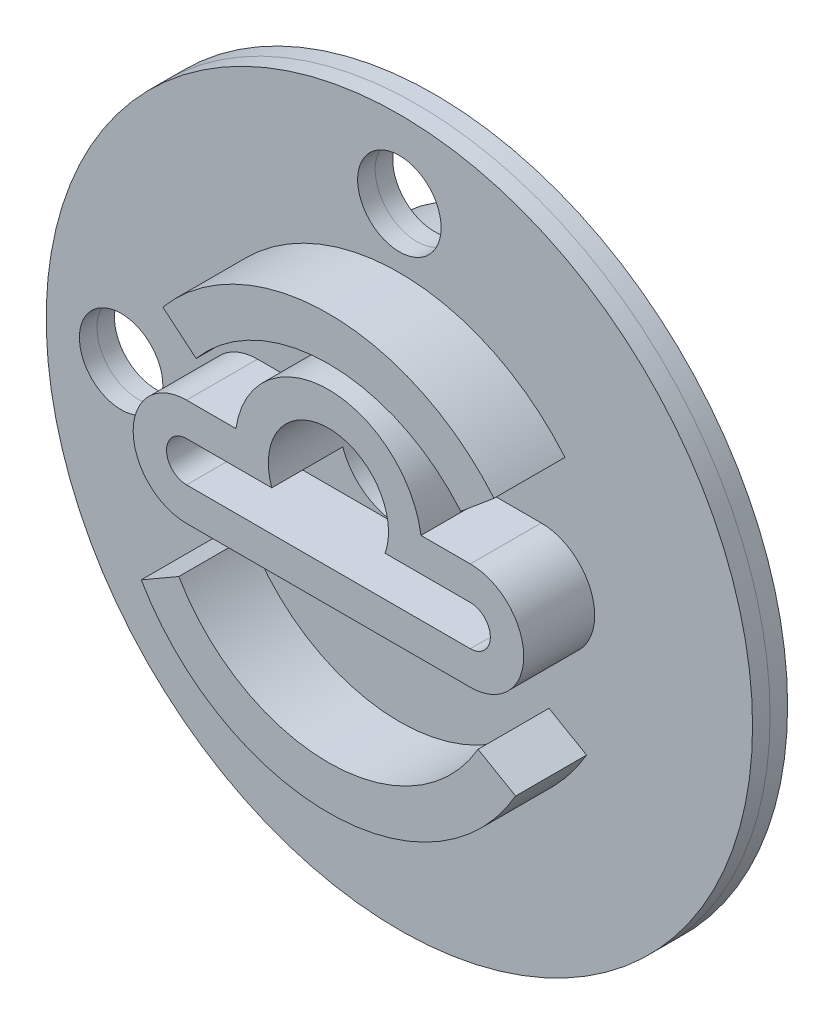
from build123d import *

# Parameters (mm, degrees)
SKETCH1_R               = 21.16
BOSS_EXTRUDE2_DEPTH     = 2.1
CUT_EXTRUDE1_DEPTH      = 30.998353288
CUT_EXTRUDE1_DEPTH_BACK = 30.998353288
SKETCH3_R               = 3.6
SKETCH6_R               = 4.85
SKETCH6_R_2             = 3.6
BOSS_EXTRUDE5_DEPTH     = 2.2
SKETCH7_R               = 11.25
SKETCH7_R_2             = 10
BOSS_EXTRUDE6_DEPTH     = 6
SPLIT1_SURFACE_1_BACK   = 61.395
SPLIT1_SURFACE_1_DEPTH  = 122.79
SPLIT1_SURFACE_2_BACK   = 61.395
SPLIT1_SURFACE_2_DEPTH  = 122.79
BOSS_EXTRUDE7_START     = 4.25
BOSS_EXTRUDE7_DEPTH     = 4.25
BOSS_EXTRUDE4_DEPTH     = 4.25
SKETCH10_R              = 2.5
CUT_EXTRUDE2_DEPTH      = 32.001632215


with BuildPart() as part:
    # Sketch1 → Boss-Extrude2 (new body)
    with BuildSketch(Plane.XY):
        Circle(SKETCH1_R)
    extrude(amount=BOSS_EXTRUDE2_DEPTH)

    # Sketch3 → Cut-Extrude1 (cut, two sides: drawn at the far end of the back side and taken through both)
    with BuildSketch(Plane.XY.offset(2.1).offset(-CUT_EXTRUDE1_DEPTH_BACK)):
        with Locations((0, 3.41)):
            Circle(SKETCH3_R)
    extrude(amount=CUT_EXTRUDE1_DEPTH + CUT_EXTRUDE1_DEPTH_BACK, mode=Mode.SUBTRACT)

    # Sketch6 → Boss-Extrude5 (add)
    with BuildSketch(Plane(origin=(0, 0, 0), x_dir=(-1, 0, 0), z_dir=(0, 0, -1))):
        with Locations(Location((0, 3.595, 0), (0, 0, 180))):
            Circle(SKETCH6_R)
        with Locations(Location((0, 3.41, 0), (0, 0, 180))):
            Circle(SKETCH6_R_2, mode=Mode.SUBTRACT)
    extrude(amount=BOSS_EXTRUDE5_DEPTH)

    # Sketch7 → Boss-Extrude6 (add)
    with BuildSketch(Plane(origin=(0, 0, 0), x_dir=(-1, 0, 0), z_dir=(0, 0, -1))):
        with Locations(Location((0, 0, 0), (0, 0, 180))):
            Circle(SKETCH7_R)
        Circle(SKETCH7_R_2, mode=Mode.SUBTRACT)
    extrude(amount=BOSS_EXTRUDE6_DEPTH)


with BuildPart() as body_2:
    # Split1: the piece behind the surface
    add(part.part)
    # Split1 surface: a surface, the sketch's curves swept straight by 122.79 mm
    with BuildLine(Plane(origin=(0, 0, 0), x_dir=(0, 0, -1), z_dir=(1, 0, 0)).offset(-SPLIT1_SURFACE_1_BACK), mode=Mode.PRIVATE) as split1_surface_1_path:
        Line((-1.05, 21.16), (-1.05, -21.16))
    split1_surface_1 = Shell.extrude(split1_surface_1_path.wire(), (1 * SPLIT1_SURFACE_1_DEPTH, 0 * SPLIT1_SURFACE_1_DEPTH, 0 * SPLIT1_SURFACE_1_DEPTH))
    split(bisect_by=split1_surface_1, keep=Keep.BOTTOM)

    # Sketch9 → Boss-Extrude7 (add)
    with BuildSketch(Plane.XY.offset(2.1).offset(BOSS_EXTRUDE7_START)):
        with BuildLine():
            Line((-8.5, -2.19), (8.5, -2.19))
            ThreePointArc((8.5, -2.19), (11.7, 1.01), (8.5, 4.21))
            Line((8.5, 4.21), (5.542562584, 4.21))
            ThreePointArc((5.542562584, 4.21), (0, 9.01), (-5.542562584, 4.21))
            Line((-5.542562584, 4.21), (-8.5, 4.21))
            ThreePointArc((-8.5, 4.21), (-11.7, 1.01), (-8.5, -2.19))
        make_face()
        with BuildLine():
            Line((-8.5, -0.19), (8.5, -0.19))
            ThreePointArc((8.5, -0.19), (9.7, 1.01), (8.5, 2.21))
            Line((8.5, 2.21), (3.39411255, 2.21))
            ThreePointArc((3.39411255, 2.21), (0, 7.01), (-3.39411255, 2.21))
            Line((-3.39411255, 2.21), (-8.5, 2.21))
            ThreePointArc((-8.5, 2.21), (-9.7, 1.01), (-8.5, -0.19))
        make_face(mode=Mode.SUBTRACT)
    extrude(amount=-BOSS_EXTRUDE7_DEPTH)

    # Sketch5 → Boss-Extrude4 (add)
    with BuildSketch(Plane.XY.offset(2.1)):
        with BuildLine():
            Line((7.928559986, 6.65285176), (9.920275538, 8.324099545))
            ThreePointArc((9.920275538, 8.324099545), (0, 12.95), (-9.920275538, 8.324099545))
            Line((-9.920275538, 8.324099545), (-7.928559986, 6.65285176))
            ThreePointArc((-7.928559986, 6.65285176), (0, 10.35), (7.928559986, 6.65285176))
        make_face()
        with BuildLine():
            Line((-8.963362929, -5.175), (-11.215028979, -6.475))
            ThreePointArc((-11.215028979, -6.475), (0, -12.95), (11.215028979, -6.475))
            Line((11.215028979, -6.475), (8.963362929, -5.175))
            ThreePointArc((8.963362929, -5.175), (0, -10.35), (-8.963362929, -5.175))
        make_face()
    extrude(amount=BOSS_EXTRUDE4_DEPTH)


with BuildPart() as part_1:
    add(part.part)

    # Split1: split by a surface, the side it looks to stays
    # Split1 surface: a surface, the sketch's curves swept straight by 122.79 mm
    with BuildLine(Plane(origin=(0, 0, 0), x_dir=(0, 0, -1), z_dir=(1, 0, 0)).offset(-SPLIT1_SURFACE_2_BACK), mode=Mode.PRIVATE) as split1_surface_2_path:
        Line((-1.05, 21.16), (-1.05, -21.16))
    split1_surface_2 = Shell.extrude(split1_surface_2_path.wire(), (1 * SPLIT1_SURFACE_2_DEPTH, 0 * SPLIT1_SURFACE_2_DEPTH, 0 * SPLIT1_SURFACE_2_DEPTH))
    split(bisect_by=split1_surface_2, keep=Keep.TOP)


with BuildPart() as cut_extrude2_tool:
    # Sketch10 → Cut-Extrude2 (new, through all)
    with BuildSketch(Plane.XY.offset(2.1)):
        with Locations((0, 16.527610664)):
            Circle(SKETCH10_R)
        with Locations((-16.670494114, 0)):
            Circle(SKETCH10_R)
    extrude(amount=-CUT_EXTRUDE2_DEPTH)


with BuildPart() as part_2:
    add(part_1.part)

    # Cut-Extrude2: cut by cut_extrude2_tool
    add(cut_extrude2_tool.part, mode=Mode.SUBTRACT)


with BuildPart() as body_2_1:
    add(body_2.part)

    # Cut-Extrude2: cut by cut_extrude2_tool
    add(cut_extrude2_tool.part, mode=Mode.SUBTRACT)


solid = Compound([part_2.part, body_2_1.part])
